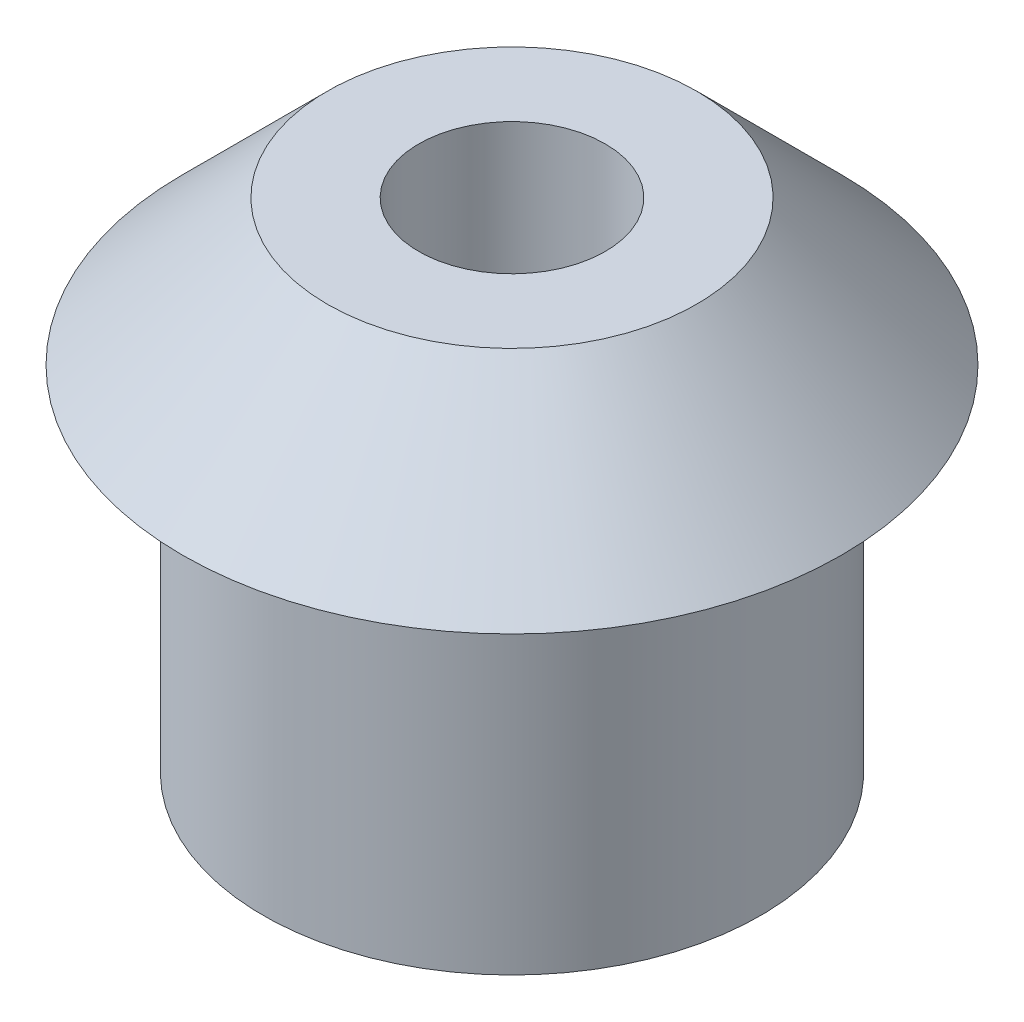
from build123d import *

# Parameters (mm, degrees)
SKETCH_1_R          = 4
SKETCH_1_R_2        = 1.5
EXTRUDE_1_DEPTH     = 5.67
SKETCH_3_R          = 1.5
CUT_EXTRUDE_1_DEPTH = 11.96266391


with BuildPart() as part:
    # 草图1 → 凸台-拉伸1 (new body)
    with BuildSketch(Plane(origin=(0, 0, 0), x_dir=(1, 0, 0), z_dir=(0, 1, 0))):
        with Locations(Location((0, 0, 0), (0, 0, 90))):
            Circle(SKETCH_1_R)
        with Locations(Location((0, 0, 0), (0, 0, 90))):
            Circle(SKETCH_1_R_2, mode=Mode.SUBTRACT)
    extrude(amount=EXTRUDE_1_DEPTH)

    # 草图2 → 旋转1 (revolve)
    with BuildSketch(Plane.XY, mode=Mode.PRIVATE) as revolve_1_sk:
        Polygon((0, 5.67), (5.3, 5.67), (2.97, 8), (0, 8), align=None)
    revolve(revolve_1_sk.sketch.rotate(Axis((0, 5.67, 0), (0, 1, 0)), 90), axis=Axis((0, 5.67, 0), (0, 1, 0)))

    # 草图3 → 切除-拉伸1 (cut, through all)
    with BuildSketch(Plane(origin=(0, 8, 0), x_dir=(1, 0, 0), z_dir=(0, 1, 0))):
        with Locations(Location((0, 0, 0), (0, 0, 90))):
            Circle(SKETCH_3_R)
    extrude(amount=-CUT_EXTRUDE_1_DEPTH, mode=Mode.SUBTRACT)


solid = part.part
